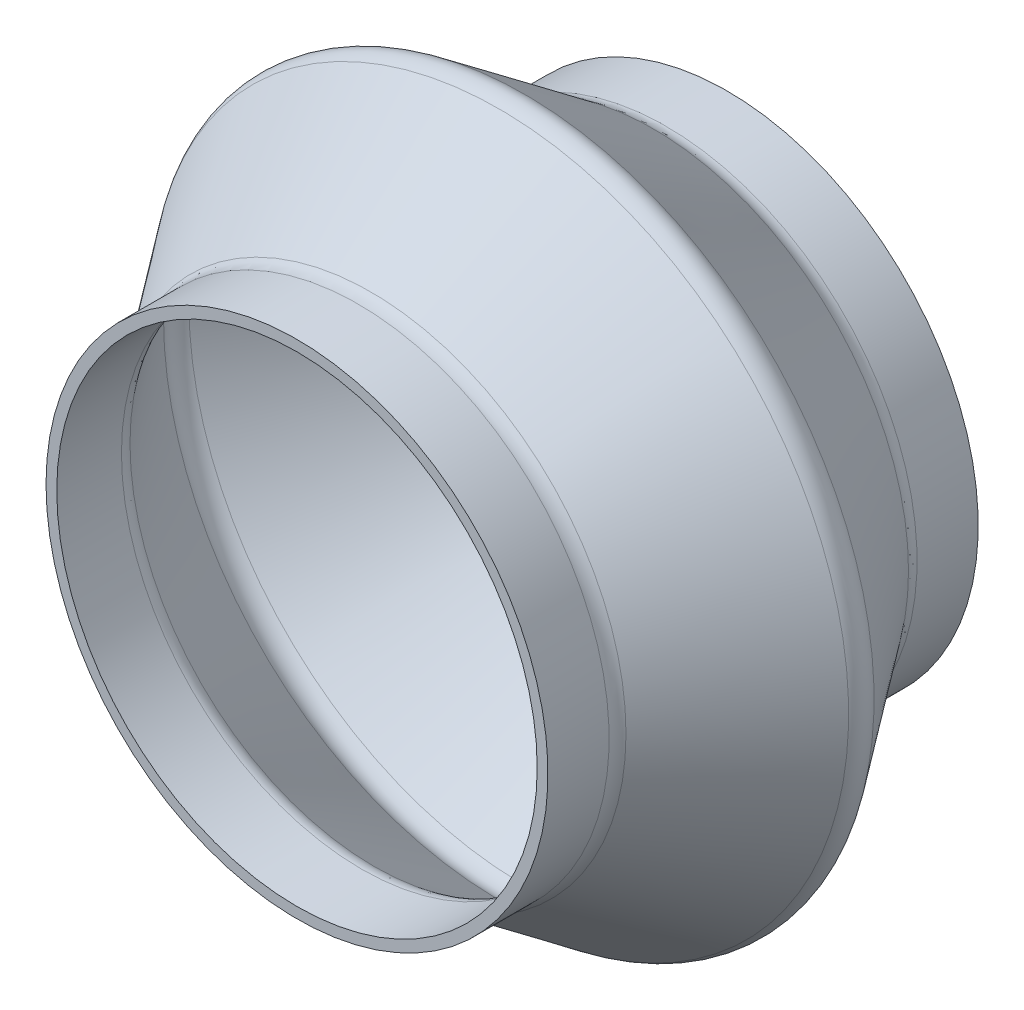
from build123d import *


with BuildPart() as part:
    # Sketch1 → Revolve1 (revolve)
    with BuildSketch(Plane(origin=(0, 0, 0), x_dir=(1, 0, 0), z_dir=(0, 1, 0))):
        with BuildLine():
            Line((-35, 0), (-35, 8.528910447))
            ThreePointArc((-35, 8.528910447), (-35.148501992, 9.461090209), (-35.579306073, 10.300982937))
            Line((-35.579306073, 10.300982937), (-48.702751771, 28.22792751))
            ThreePointArc((-48.702751771, 28.22792751), (-49.282057844, 30), (-48.702751771, 31.77207249))
            Line((-48.702751771, 31.77207249), (-35.579306073, 49.699017063))
            ThreePointArc((-35.579306073, 49.699017063), (-35.148501992, 50.538909791), (-35, 51.471089553))
            Line((-35, 51.471089553), (-35, 60))
            Line((-35, 60), (-33.5, 60))
            Line((-33.5, 60), (-33.5, 50.980726369))
            ThreePointArc((-33.5, 50.980726369), (-33.648501992, 50.048546606), (-34.079306073, 49.208653878))
            Line((-34.079306073, 49.208653878), (-46.843780693, 31.77207249))
            ThreePointArc((-46.843780693, 31.77207249), (-47.423086766, 30), (-46.843780693, 28.22792751))
            Line((-46.843780693, 28.22792751), (-34.079306073, 10.791346122))
            ThreePointArc((-34.079306073, 10.791346122), (-33.648501992, 9.951453394), (-33.5, 9.019273631))
            Line((-33.5, 9.019273631), (-33.5, 0))
            Line((-33.5, 0), (-35, 0))
        make_face()
    revolve(axis=Axis((0, 0, -72.546995865), (0, 0, 1)))


solid = part.part
